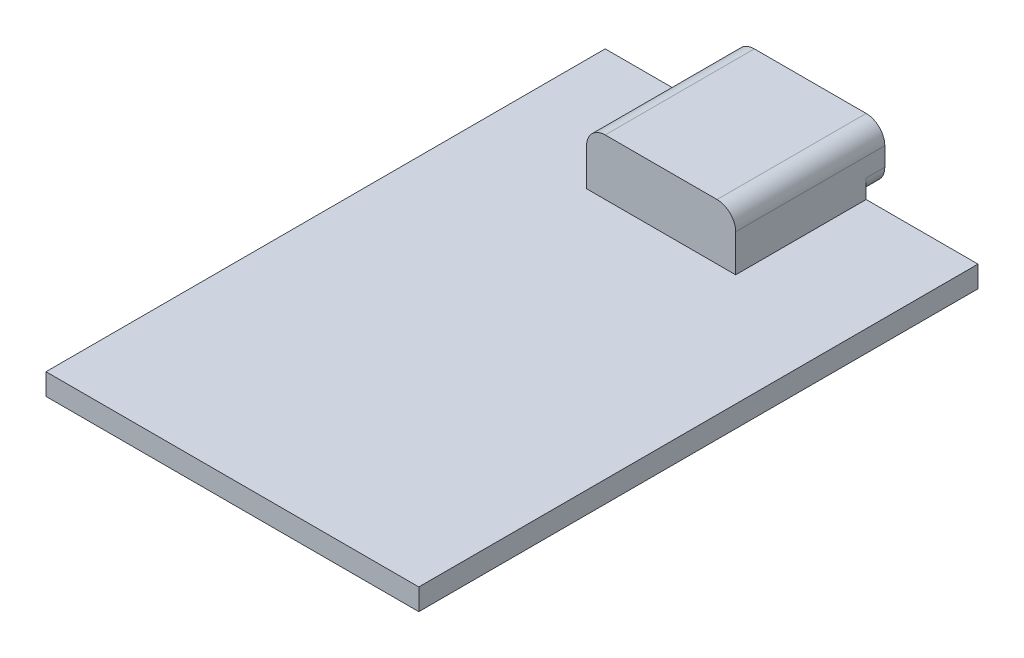
from build123d import *

# Parameters (mm, degrees)
CROQUIS1_W              = 20
CROQUIS1_H              = 30
SALIENTE_EXTRUIR1_DEPTH = 1.15
CROQUIS2_W              = 8
CROQUIS2_H              = 8
SALIENTE_EXTRUIR2_DEPTH = 3
REDONDEO1_R             = 1


with BuildPart() as part:
    # Croquis1 → Saliente-Extruir1 (new body)
    with BuildSketch(Plane(origin=(0, 0, 0), x_dir=(1, 0, 0), z_dir=(0, 1, 0))):
        Rectangle(CROQUIS1_W, CROQUIS1_H)
    extrude(amount=SALIENTE_EXTRUIR1_DEPTH)

    # Croquis2 → Saliente-Extruir2 (add)
    with BuildSketch(Plane(origin=(0, 1.15, 0), x_dir=(1, 0, 0), z_dir=(0, 1, 0))):
        with Locations((0, 12)):
            Rectangle(CROQUIS2_W, CROQUIS2_H)
    extrude(amount=SALIENTE_EXTRUIR2_DEPTH)

    # Redondeo1
    redondeo1_edges = [part.edges().sort_by_distance(p)[0] for p in [
        (-4, 1.15, -15.5),
        (4, 1.15, -15.5),
        (-4, 4.15, -12),
        (4, 4.15, -12),
    ]]
    fillet(redondeo1_edges, radius=REDONDEO1_R)


solid = part.part
